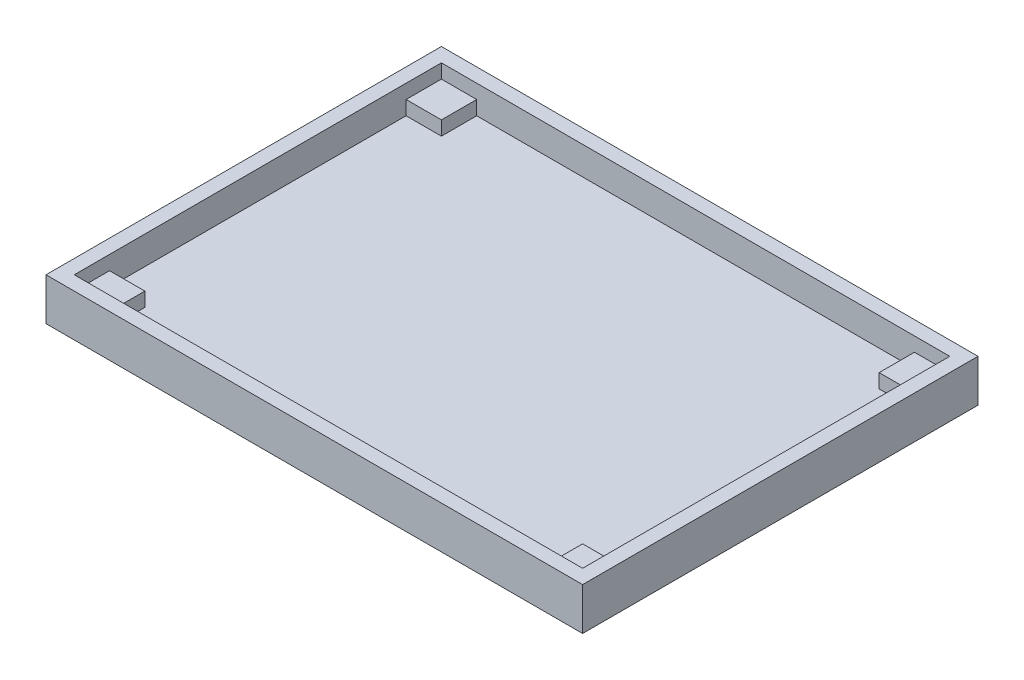
from build123d import *

# Parameters (mm, degrees)
SKETCH1_W           = 76
SKETCH1_H           = 56
BOSS_EXTRUDE1_DEPTH = 2
SKETCH1_4_W         = 5
SKETCH1_4_H         = 5
BOSS_EXTRUDE2_DEPTH = 4
SKETCH1_5_W         = 76
SKETCH1_5_H         = 56
SKETCH1_5_W_2       = 72
SKETCH1_5_H_2       = 52
BOSS_EXTRUDE3_DEPTH = 6


with BuildPart() as part:
    # Sketch1 → Boss-Extrude1 (new body)
    with BuildSketch(Plane(origin=(0, 0, 0), x_dir=(1, 0, 0), z_dir=(0, 1, 0))):
        with Locations((35, 25)):
            Rectangle(SKETCH1_W, SKETCH1_H)
    extrude(amount=BOSS_EXTRUDE1_DEPTH)

    # Sketch1<4> → Boss-Extrude2 (add)
    with BuildSketch(Plane(origin=(0, 0, 0), x_dir=(1, 0, 0), z_dir=(0, 1, 0))):
        with Locations((1.5, 48.5)):
            Rectangle(SKETCH1_4_W, SKETCH1_4_H)
        with Locations((68.5, 48.5)):
            Rectangle(SKETCH1_4_W, SKETCH1_4_H)
        with Locations((1.5, 1.5)):
            Rectangle(SKETCH1_4_W, SKETCH1_4_H)
        with Locations((68.5, 1.5)):
            Rectangle(SKETCH1_4_W, SKETCH1_4_H)
    extrude(amount=BOSS_EXTRUDE2_DEPTH)

    # Sketch1<5> → Boss-Extrude3 (add)
    with BuildSketch(Plane(origin=(0, 0, 0), x_dir=(1, 0, 0), z_dir=(0, 1, 0))):
        with Locations((35, 25)):
            Rectangle(SKETCH1_5_W, SKETCH1_5_H)
        with Locations((35, 25)):
            Rectangle(SKETCH1_5_W_2, SKETCH1_5_H_2, mode=Mode.SUBTRACT)
    extrude(amount=BOSS_EXTRUDE3_DEPTH)


solid = part.part
